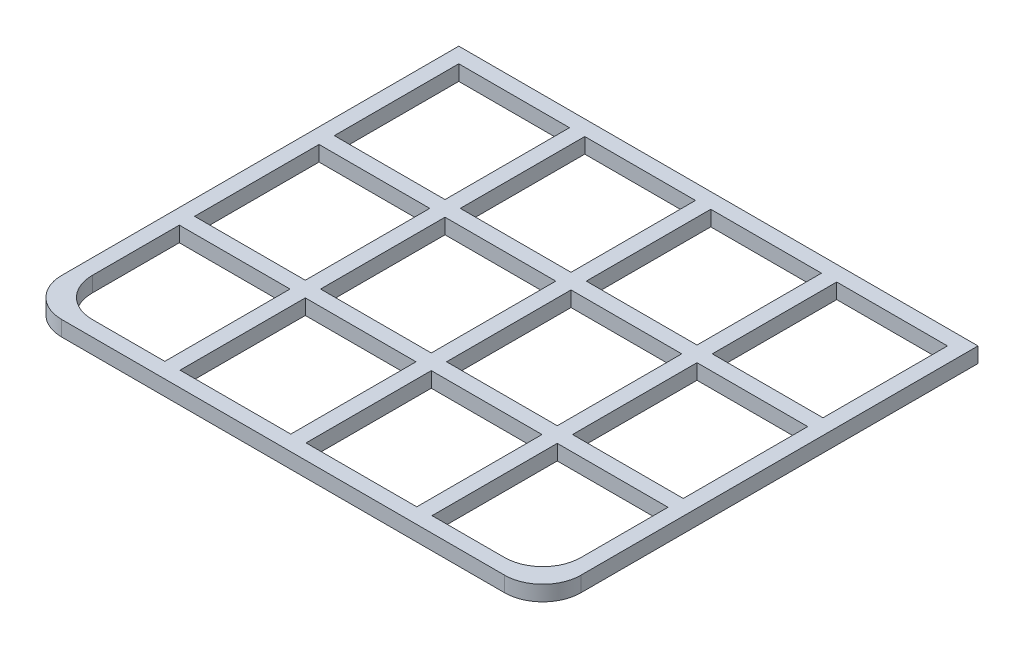
from build123d import *

# Parameters (mm, degrees)
SKETCH1_W   = 145
SKETCH1_H   = 163
SKETCH1_H_2 = 164
BAGA_DEPTH  = 20


with BuildPart() as part:
    # Sketch1 → baga (new body)
    with BuildSketch(Plane(origin=(0, 0, 0), x_dir=(1, 0, 0), z_dir=(0, 1, 0))):
        with BuildLine():
            Line((0, 0), (-680, 0))
            Line((-680, 0), (-680, -520))
            ThreePointArc((-680, -520), (-665.355339059, -555.355339059), (-630, -570))
            Line((-630, -570), (-50, -570))
            ThreePointArc((-50, -570), (-14.644660941, -555.355339059), (0, -520))
            Line((0, -520), (0, 0))
        make_face()
        with Locations((-587.5, -284.5)):
            Rectangle(SKETCH1_W, SKETCH1_H, mode=Mode.SUBTRACT)
        with Locations((-92.5, -101.5)):
            Rectangle(SKETCH1_W, SKETCH1_H, mode=Mode.SUBTRACT)
        with BuildLine():
            Line((-70, -550), (-165, -550))
            Line((-165, -550), (-165, -386))
            Line((-165, -386), (-20, -386))
            Line((-20, -386), (-20, -500))
            ThreePointArc((-20, -500), (-34.644660941, -535.355339059), (-70, -550))
        make_face(mode=Mode.SUBTRACT)
        with Locations((-587.5, -101.5)):
            Rectangle(SKETCH1_W, SKETCH1_H, mode=Mode.SUBTRACT)
        with BuildLine():
            Line((-660, -386), (-515, -386))
            Line((-515, -386), (-515, -550))
            Line((-515, -550), (-610, -550))
            ThreePointArc((-610, -550), (-645.355339059, -535.355339059), (-660, -500))
            Line((-660, -500), (-660, -386))
        make_face(mode=Mode.SUBTRACT)
        with Locations((-422.5, -101.5)):
            Rectangle(SKETCH1_W, SKETCH1_H, mode=Mode.SUBTRACT)
        with Locations((-257.5, -101.5)):
            Rectangle(SKETCH1_W, SKETCH1_H, mode=Mode.SUBTRACT)
        with Locations((-422.5, -284.5)):
            Rectangle(SKETCH1_W, SKETCH1_H, mode=Mode.SUBTRACT)
        with Locations((-257.5, -284.5)):
            Rectangle(SKETCH1_W, SKETCH1_H, mode=Mode.SUBTRACT)
        with Locations((-92.5, -284.5)):
            Rectangle(SKETCH1_W, SKETCH1_H, mode=Mode.SUBTRACT)
        with Locations((-422.5, -468)):
            Rectangle(SKETCH1_W, SKETCH1_H_2, mode=Mode.SUBTRACT)
        with Locations((-257.5, -468)):
            Rectangle(SKETCH1_W, SKETCH1_H_2, mode=Mode.SUBTRACT)
    extrude(amount=BAGA_DEPTH)


solid = part.part
